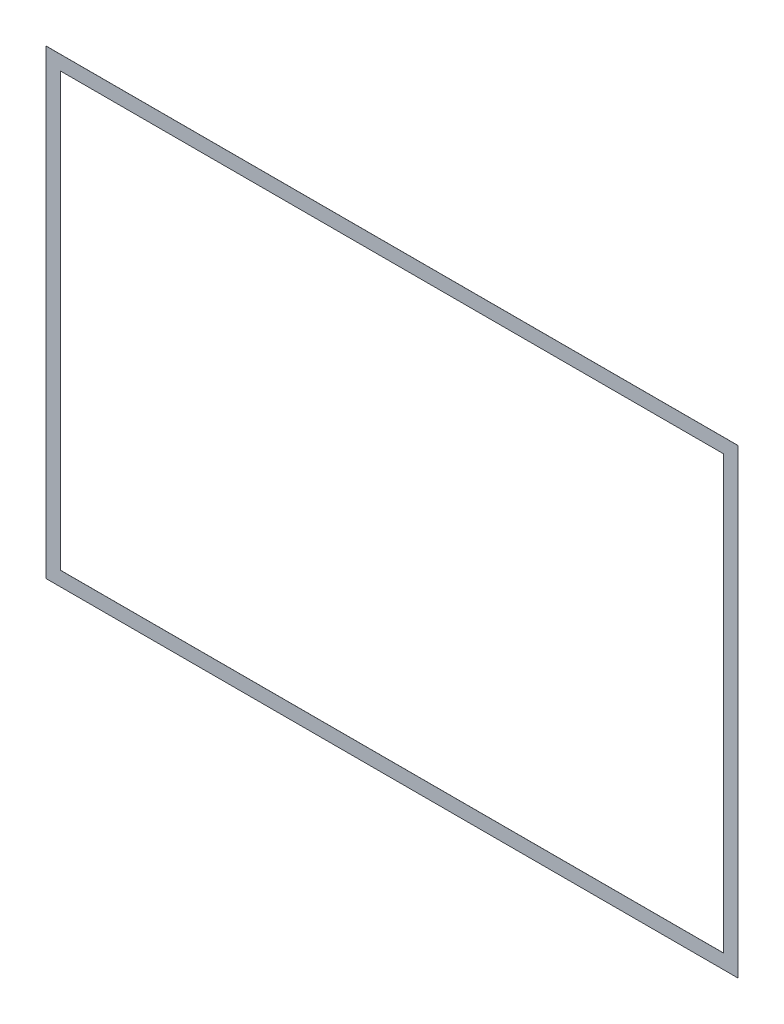
from build123d import *

# Parameters (mm, degrees)
SKETCH4_W           = 600
SKETCH4_H           = 400
SKETCH4_W_2         = 575
SKETCH4_H_2         = 375
BOSS_EXTRUDE4_DEPTH = 0.026


with BuildPart() as part:
    # Sketch4 → Boss-Extrude4 (new, symmetric)
    with BuildSketch(Plane.XY):
        Rectangle(SKETCH4_W, SKETCH4_H)
        Rectangle(SKETCH4_W_2, SKETCH4_H_2, mode=Mode.SUBTRACT)
    extrude(amount=BOSS_EXTRUDE4_DEPTH, both=True)


solid = part.part
